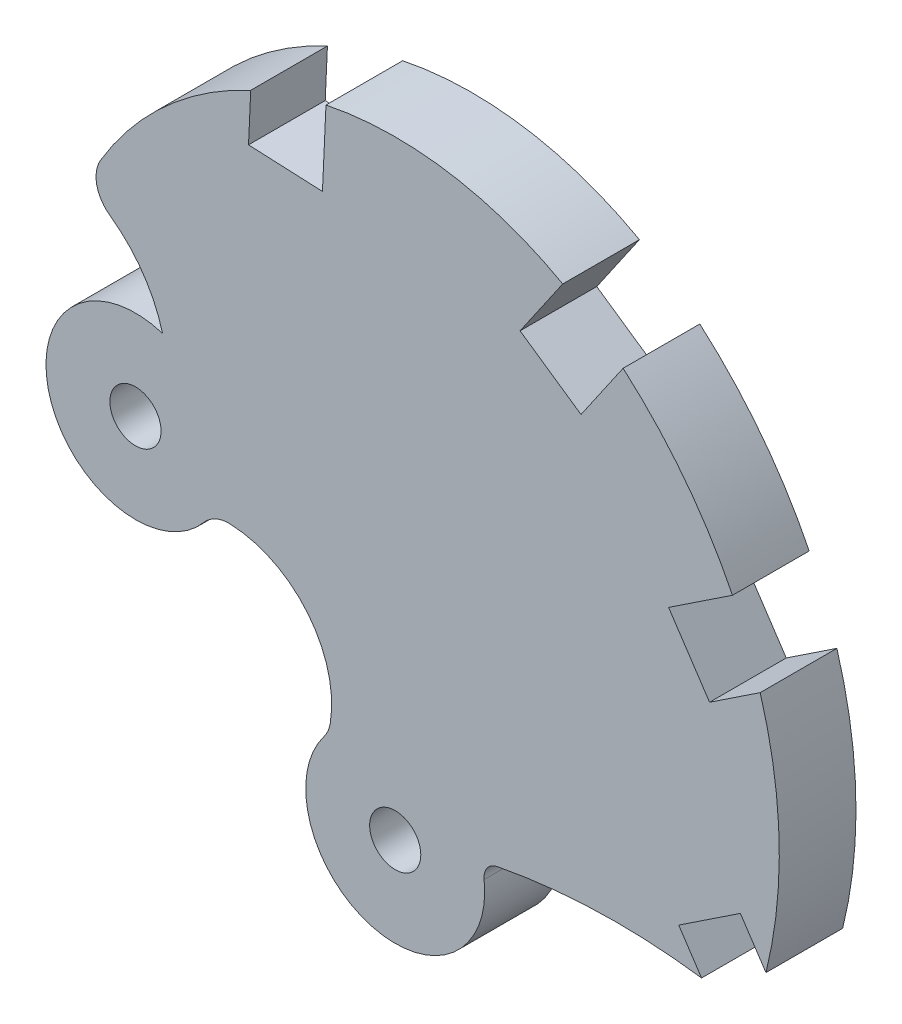
from build123d import *

# Parameters (mm, degrees)
SKETCH_1_R          = 1
EXTRUDE_1_DEPTH     = 3
CUT_EXTRUDE_1_DEPTH = 3
FILLET_3_R          = 0.635
FILLET_4_R          = 1.27
FILLET_5_R          = 1.27


with BuildPart() as part:
    # 스케치1 → 보스-돌출1 (new body)
    with BuildSketch(Plane.XY):
        with BuildLine():
            ThreePointArc((13.953884727, -10.4604054), (14.378598245, 0.342544853), (8.460782986, 9.390394228))
            ThreePointArc((8.460782986, 9.390394228), (-2.974719352, 12.059159282), (-12.129056489, 4.704491905))
            ThreePointArc((-12.129056489, 4.704491905), (-10.212753099, 3.28852822), (-9.098885827, 1.182234902))
            ThreePointArc((-9.098885827, 1.182234902), (-13.440703993, -3.372455138), (-7.178058569, -3.985528264))
            ThreePointArc((-7.178058569, -3.985528264), (-3.531014476, -5.328655626), (-2.617256463, -9.106216747))
            ThreePointArc((-2.617256463, -9.106216747), (-0.772979034, -14.843576338), (3.363017442, -10.4604054))
            ThreePointArc((3.363017442, -10.4604054), (8.658451084, -9.881913195), (13.953884727, -10.4604054))
        make_face()
        with Locations((-10.16, -2.153036707)):
            Circle(SKETCH_1_R, mode=Mode.SUBTRACT)
        with Locations((0, -11.43)):
            Circle(SKETCH_1_R, mode=Mode.SUBTRACT)
    extrude(amount=EXTRUDE_1_DEPTH)

    # 스케치2 → 컷-돌출1 (cut)
    with BuildSketch(Plane.XY.offset(3)):
        Polygon((12.294266072, -0.611273139), (10.692062425, 1.799944079), (13.190733117, 3.460258739), (14.792936764, 1.049041521), align=None)
        Polygon((-5.738219006, 9.252553702), (-2.846256152, 9.119979742), (-2.708873811, 12.11683244), (-5.600836664, 12.2494064), align=None)
        Polygon((4.882638145, 8.263381657), (7.266602202, 6.620901711), (8.96865396, 9.091330786), (6.584689903, 10.733810732), align=None)
        Polygon((11.087961457, -8.762836531), (13.499178676, -7.160632884), (15.159493336, -9.659303577), (12.748276117, -11.261507224), align=None)
    extrude(amount=-CUT_EXTRUDE_1_DEPTH, mode=Mode.SUBTRACT)

    # 필렛3
    fillet_3_edges = [part.edges().sort_by_distance(p)[0] for p in [
        (3.363017442, -10.4604054, 1.5),
    ]]
    fillet(fillet_3_edges, radius=FILLET_3_R)

    # 필렛4
    fillet_4_edges = [part.edges().sort_by_distance(p)[0] for p in [
        (-12.129056489, 4.704491905, 1.5),
    ]]
    fillet(fillet_4_edges, radius=FILLET_4_R)

    # 필렛5
    fillet_5_edges = [part.edges().sort_by_distance(p)[0] for p in [
        (-2.617256463, -9.106216747, 1.5),
        (-7.178058569, -3.985528264, 1.5),
    ]]
    fillet(fillet_5_edges, radius=FILLET_5_R)


solid = part.part
